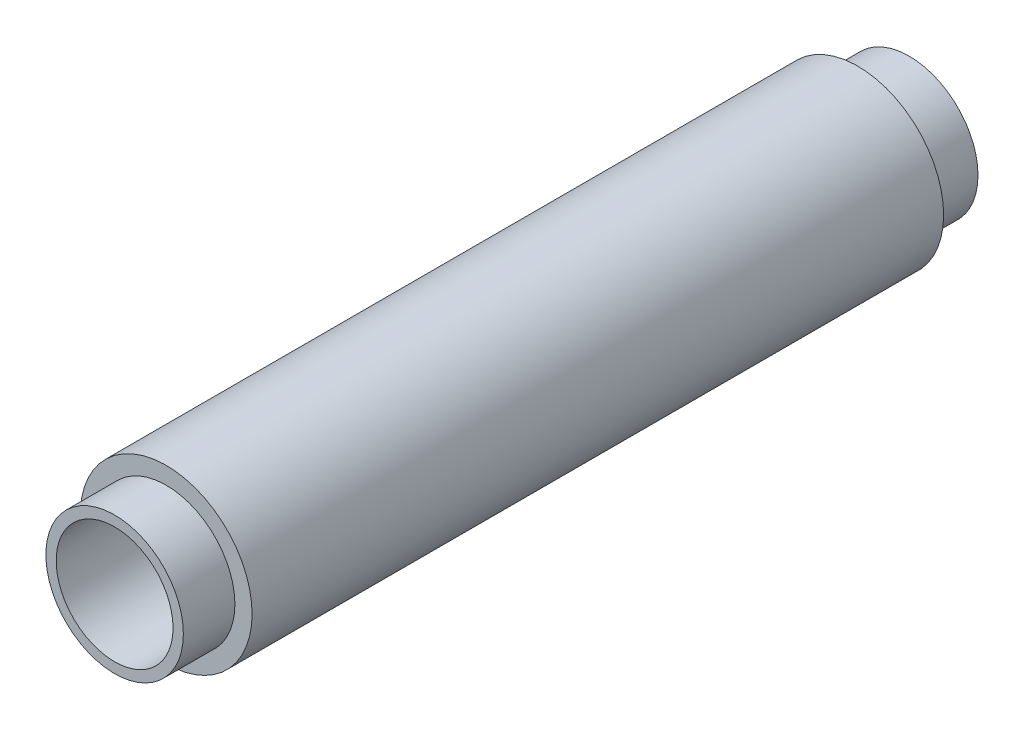
from build123d import *


with BuildPart() as part:
    # Эскиз1 → Повернуть1 (revolve)
    with BuildSketch(Plane(origin=(0, 0, 0), x_dir=(1, 0, 0), z_dir=(0, 1, 0)), mode=Mode.PRIVATE) as revolve_1_sk:
        Polygon((-25, 0), (-17, 0), (-17, -115.6), (-20, -115.6), (-20, -100.6), (-25, -100.6), align=None)
    revolve_1 = revolve(revolve_1_sk.sketch.rotate(Axis((0, 0, 1000), (0, 0, -1)), 180), axis=Axis((0, 0, 1000), (0, 0, -1)))

    # Зеркальное отражение1: Повернуть1 across plane
    add(revolve_1.mirror(Plane(origin=(-25, 0, 0), x_dir=(1, 0, 0), z_dir=(0, 0, 1))))


solid = part.part
